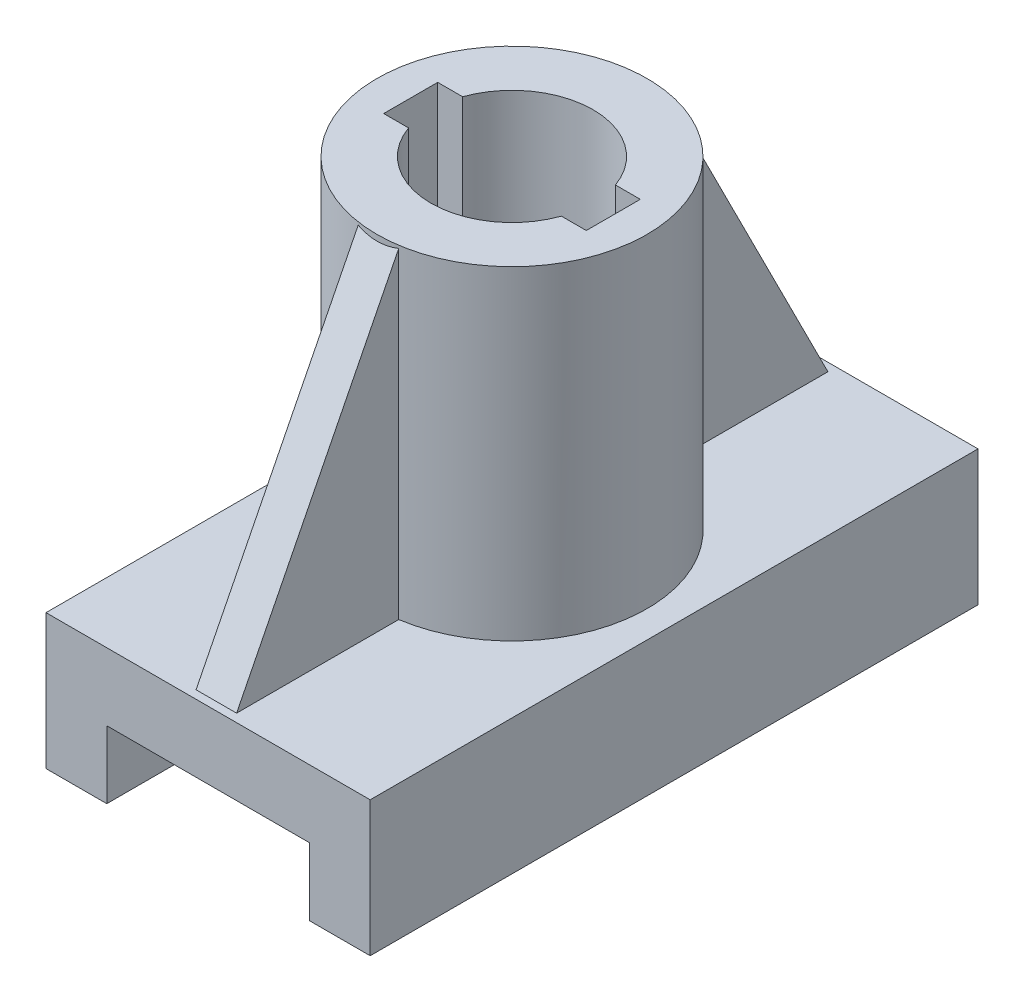
from build123d import *

# Parameters (mm, degrees)
EXTRUDE_1_DEPTH = 90
SKETCH_2_R      = 20
EXTRUDE_2_DEPTH = 48
RIB_44_REACH    = 117.326
SKETCH_5_WALL_W = 285.43665717
SKETCH_5_WALL_H = 6
RIB_45_REACH    = 117.326
SKETCH_7_WALL_W = 285.43665717
SKETCH_7_WALL_H = 6


with BuildPart() as part:
    # Эскиз1 → Бобышка-Вытянуть1 (new body)
    with BuildSketch(Plane.XY):
        Polygon((-15, 0), (-15, 10), (15, 10), (15, 0), (24, 0), (24, 20), (-24, 20), (-24, 0), align=None)
    extrude(amount=-EXTRUDE_1_DEPTH)

    # Эскиз2 → Бобышка-Вытянуть2 (add)
    with BuildSketch(Plane(origin=(0, 20, 0), x_dir=(1, 0, 0), z_dir=(0, 1, 0))):
        with Locations(Location((0, 45, 0), (0, 0, 270))):
            Circle(SKETCH_2_R)
        with BuildLine():
            Line((-11.313708499, 49), (-15, 49))
            Line((-15, 49), (-15, 41))
            Line((-15, 41), (-11.313708499, 41))
            ThreePointArc((-11.313708499, 41), (0, 33), (11.313708499, 41))
            Line((11.313708499, 41), (15, 41))
            Line((15, 41), (15, 49))
            Line((15, 49), (11.313708499, 49))
            ThreePointArc((11.313708499, 49), (0, 57), (-11.313708499, 49))
        make_face(mode=Mode.SUBTRACT)
    extrude(amount=EXTRUDE_2_DEPTH)

    # Эскиз5 wall → Ребро44 (add, up to next)
    with BuildSketch(Plane(origin=(0, 43.563200657, -13.108782301), x_dir=(0, -0.892792260785, 0.45046862164), z_dir=(0, -0.45046862164, -0.892792260785)), mode=Mode.PRIVATE) as rib_44_sk1:
        Rectangle(SKETCH_5_WALL_W, SKETCH_5_WALL_H)
    rib_44_tool1 = extrude(rib_44_sk1.sketch, amount=RIB_44_REACH, mode=Mode.PRIVATE) - part.part
    add(rib_44_tool1.solids().sort_by_distance((0, 43.563200657, -13.108782301))[0])

    # Эскиз7 wall → Ребро45 (add, up to next)
    with BuildSketch(Plane(origin=(0, 43.563200657, -76.889084379), x_dir=(0, -0.892792260785, -0.45046862164), z_dir=(0, 0.45046862164, -0.892792260785)), mode=Mode.PRIVATE) as rib_45_sk1:
        Rectangle(SKETCH_7_WALL_W, SKETCH_7_WALL_H)
    rib_45_tool1 = extrude(rib_45_sk1.sketch, amount=-RIB_45_REACH, mode=Mode.PRIVATE) - part.part
    add(rib_45_tool1.solids().sort_by_distance((0, 43.563200657, -76.889084379))[0])


solid = part.part
